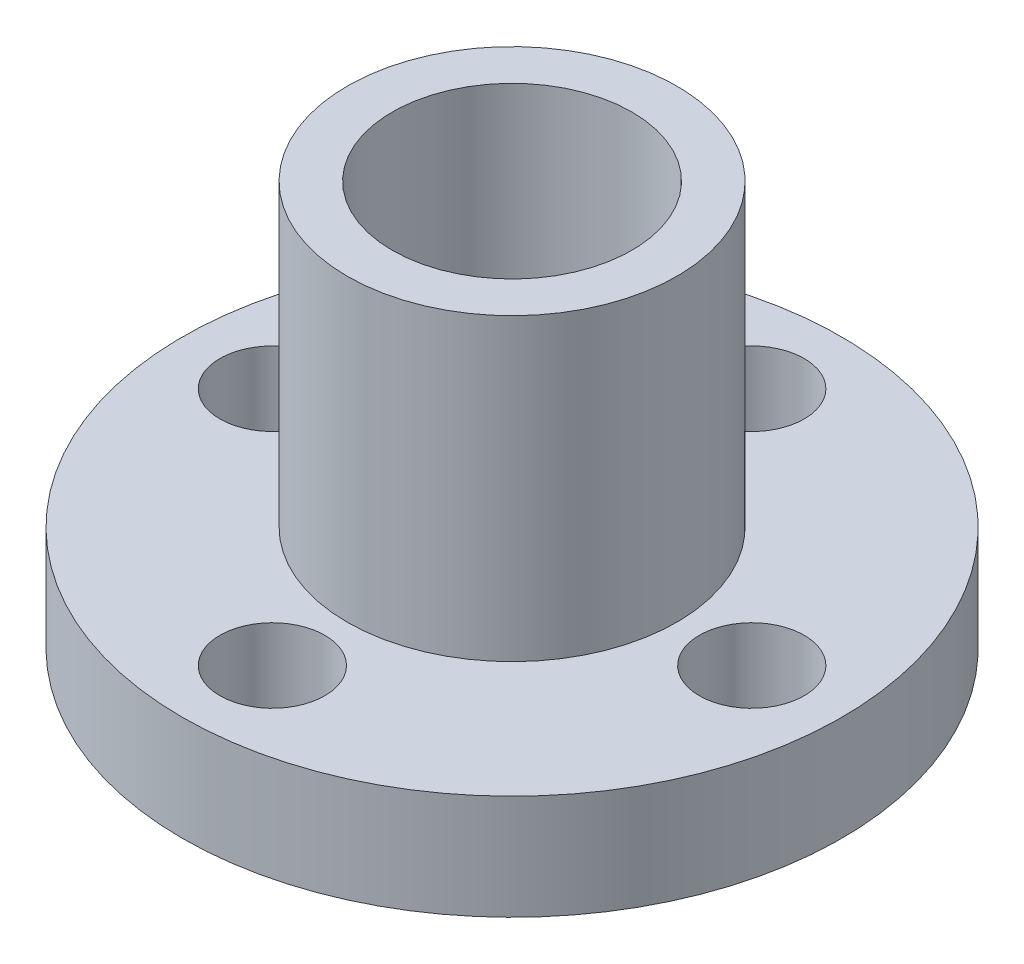
from build123d import *

# Parameters (mm, degrees)
SKETCH_1_R          = 5.5
SKETCH_1_R_2        = 4
EXTRUDE_1_DEPTH     = 1.5
SKETCH_2_R          = 11
SKETCH_2_R_2        = 4
EXTRUDE_2_DEPTH     = 3.5
SKETCH_3_R          = 5.5
SKETCH_3_R_2        = 4
EXTRUDE_3_DEPTH     = 10
SKETCH_4_R          = 1.75
CUT_EXTRUDE_1_DEPTH = 19.493242009


with BuildPart() as part:
    # 草图1 → 凸台-拉伸1 (new body)
    with BuildSketch(Plane(origin=(0, 0, 0), x_dir=(1, 0, 0), z_dir=(0, 1, 0))):
        with Locations(Location((0, 0, 0), (0, 0, 270))):
            Circle(SKETCH_1_R)
        with Locations(Location((0, 0, 0), (0, 0, 270))):
            Circle(SKETCH_1_R_2, mode=Mode.SUBTRACT)
    extrude(amount=EXTRUDE_1_DEPTH)

    # 草图2 → 凸台-拉伸2 (add)
    with BuildSketch(Plane(origin=(0, 1.5, 0), x_dir=(1, 0, 0), z_dir=(0, 1, 0))):
        with Locations(Location((0, 0, 0), (0, 0, 270))):
            Circle(SKETCH_2_R)
        with Locations(Location((0, 0, 0), (0, 0, 270))):
            Circle(SKETCH_2_R_2, mode=Mode.SUBTRACT)
    extrude(amount=EXTRUDE_2_DEPTH)

    # 草图3 → 凸台-拉伸3 (add)
    with BuildSketch(Plane(origin=(0, 5, 0), x_dir=(1, 0, 0), z_dir=(0, 1, 0))):
        with Locations(Location((0, 0, 0), (0, 0, 270))):
            Circle(SKETCH_3_R)
        with Locations(Location((0, 0, 0), (0, 0, 270))):
            Circle(SKETCH_3_R_2, mode=Mode.SUBTRACT)
    extrude(amount=EXTRUDE_3_DEPTH)

    # 草图4 → 切除-拉伸1 (cut, through all)
    with BuildSketch(Plane(origin=(0, 5, 0), x_dir=(1, 0, 0), z_dir=(0, 1, 0))):
        with Locations(Location((0, 8, 0), (0, 0, 270))):
            Circle(SKETCH_4_R)
        with Locations(Location((8, 0, 0), (0, 0, 270))):
            Circle(SKETCH_4_R)
        with Locations(Location((0, -8, 0), (0, 0, 270))):
            Circle(SKETCH_4_R)
        with Locations(Location((-8, 0, 0), (0, 0, 270))):
            Circle(SKETCH_4_R)
    extrude(amount=-CUT_EXTRUDE_1_DEPTH, mode=Mode.SUBTRACT)


solid = part.part
